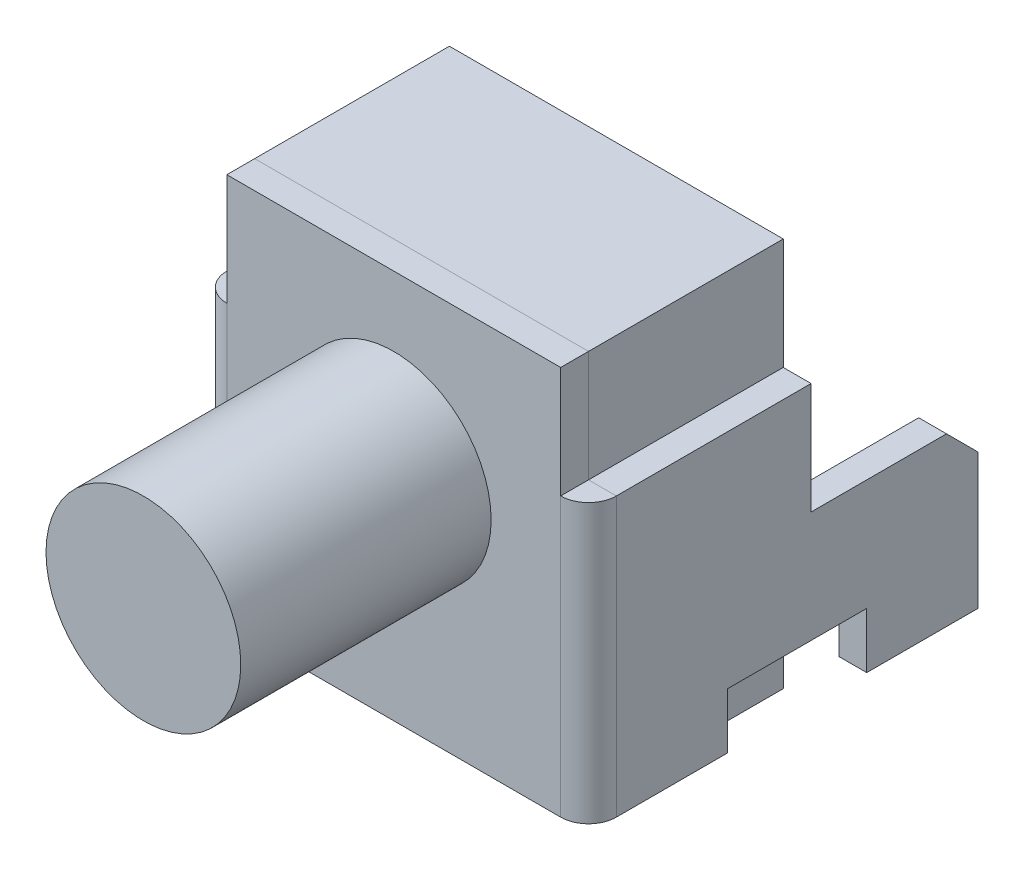
from build123d import *

# Parameters (mm, degrees)
EXTRUDE_1_DEPTH = 0.5
SKETCH_1_3_W    = 1.5
SKETCH_1_3_H    = 1
SKETCH_1_3_W_2  = 3.5
SKETCH_1_3_H_2  = 2
EXTRUDE_2_DEPTH = 6
EXTRUDE_START   = -6
EXTRUDE_3_DEPTH = 0.5
SKETCH_2_R      = 1.75
EXTRUDE_4_DEPTH = 5
SKETCH_3_W      = 6
SKETCH_3_H      = 7
SKETCH_3_R      = 1.75
EXTRUDE_5_DEPTH = 0.5
SKETCH_5_W      = 0.5
SKETCH_5_H      = 5
REVOLVE_1_ANGLE = 90
SKETCH_6_W      = 0.5
SKETCH_6_H      = 5
REVOLVE_2_ANGLE = 90


with BuildPart() as part:
    # Эскиз1 → Бобышка-Вытянуть1 (new body)
    with BuildSketch(Plane(origin=(0, 0, 0), x_dir=(0, 0, -1), z_dir=(1, 0, 0))):
        Polygon((0, 5), (0, 0), (2, 0), (2, 1), (4.5, 1), (4.5, 0), (6.5, 0), (6.5, 2.434314575), (5.934314575, 3), (3.5, 3), (3.5, 5), align=None)
    extrude(amount=EXTRUDE_1_DEPTH)


with BuildPart() as body_2:
    # Эскиз1<3> → Бобышка-Вытянуть2 (new body)
    with BuildSketch(Plane(origin=(0, 0, 0), x_dir=(0, 0, -1), z_dir=(1, 0, 0))):
        with Locations((2.75, 0.5)):
            Rectangle(SKETCH_1_3_W, SKETCH_1_3_H)
        Polygon((0, 5), (0, 0), (2, 0), (2, 1), (3.5, 1), (3.5, 3), (3.5, 5), align=None)
        with Locations((1.75, 6)):
            Rectangle(SKETCH_1_3_W_2, SKETCH_1_3_H_2)
    extrude(amount=-EXTRUDE_2_DEPTH)


with BuildPart() as body_3:
    # Эскиз1<4> → Бобышка-Вытянуть3 (new body)
    with BuildSketch(Plane(origin=(0, 0, 0), x_dir=(0, 0, -1), z_dir=(1, 0, 0)).offset(EXTRUDE_START)):
        Polygon((0, 5), (0, 0), (2, 0), (2, 1), (4.5, 1), (4.5, 0), (6.5, 0), (6.5, 2.434314575), (5.934314575, 3), (3.5, 3), (3.5, 5), align=None)
    extrude(amount=-EXTRUDE_3_DEPTH)


with BuildPart() as body_4:
    # Эскиз2 → Бобышка-Вытянуть4 (new body)
    with BuildSketch(Plane.XY):
        with Locations((-3, 4)):
            Circle(SKETCH_2_R)
    extrude(amount=EXTRUDE_4_DEPTH)


with BuildPart() as body_5:
    # Эскиз3 → Бобышка-Вытянуть5 (new body)
    with BuildSketch(Plane.XY):
        with Locations((-3, 3.5)):
            Rectangle(SKETCH_3_W, SKETCH_3_H)
        with Locations((-3, 4)):
            Circle(SKETCH_3_R, mode=Mode.SUBTRACT)
    extrude(amount=EXTRUDE_5_DEPTH)


with BuildPart() as body_6:
    # Эскиз5 → Повернуть1 (revolve)
    with BuildSketch(Plane.XY):
        with Locations((-6.25, 2.5)):
            Rectangle(SKETCH_5_W, SKETCH_5_H)
    revolve(axis=Axis((-6, 0, 0), (0, 1, 0)), revolution_arc=REVOLVE_1_ANGLE)


with BuildPart() as body_7:
    # Эскиз6 → Повернуть2 (revolve)
    with BuildSketch(Plane.XY):
        with Locations((0.25, 2.5)):
            Rectangle(SKETCH_6_W, SKETCH_6_H)
    revolve(axis=Axis((0, 5, 0), (0, -1, 0)), revolution_arc=REVOLVE_2_ANGLE)


solid = Compound([part.part, body_2.part, body_3.part, body_4.part, body_5.part, body_6.part, body_7.part])
